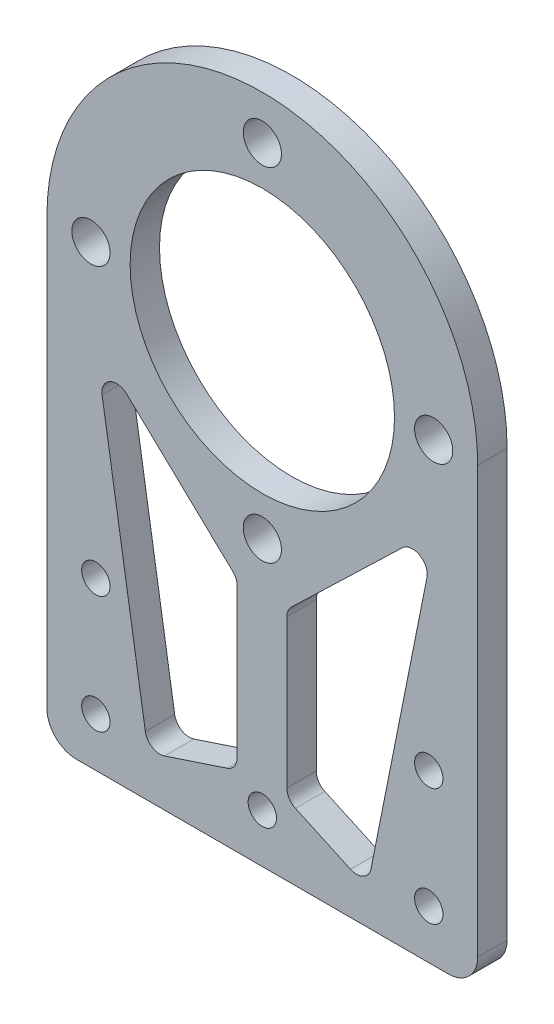
from build123d import *

# Parameters (mm, degrees)
SKETCH_1_R          = 13.5
SKETCH_1_R_2        = 1.95
EXTRUDE_1_DEPTH     = 3
SKETCH_2_R          = 1.45
CUT_EXTRUDE_1_DEPTH = 10
FILLET_1_R          = 3
CUT_EXTRUDE_2_DEPTH = 52.529117982
FILLET_2_R          = 1.5


with BuildPart() as part:
    # 草图1 → 凸台-拉伸1 (new body)
    with BuildSketch(Plane.XY):
        with BuildLine():
            Line((-22, 0), (-22, -46.5))
            Line((-22, -46.5), (22, -46.5))
            Line((22, -46.5), (22, 0))
            ThreePointArc((22, 0), (0, 22), (-22, 0))
        make_face()
        Circle(SKETCH_1_R, mode=Mode.SUBTRACT)
        with Locations((0, 17.5)):
            Circle(SKETCH_1_R_2, mode=Mode.SUBTRACT)
        with Locations((17.5, 0)):
            Circle(SKETCH_1_R_2, mode=Mode.SUBTRACT)
        with Locations((-17.5, 0)):
            Circle(SKETCH_1_R_2, mode=Mode.SUBTRACT)
        with Locations((0, -17.5)):
            Circle(SKETCH_1_R_2, mode=Mode.SUBTRACT)
    extrude(amount=EXTRUDE_1_DEPTH)

    # 草图2 → 切除-拉伸1 (cut)
    with BuildSketch(Plane.XY.offset(3)):
        with Locations((0, -41.5)):
            Circle(SKETCH_2_R)
        with Locations((17, -41.5)):
            Circle(SKETCH_2_R)
        with Locations((-17, -41.5)):
            Circle(SKETCH_2_R)
        with Locations((-17, -29.5)):
            Circle(SKETCH_2_R)
        with Locations((17, -29.5)):
            Circle(SKETCH_2_R)
    extrude(amount=-CUT_EXTRUDE_1_DEPTH, mode=Mode.SUBTRACT)

    # 圆角1
    fillet_1_edges = [part.edges().sort_by_distance(p)[0] for p in [
        (22, -46.5, 1.5),
        (-22, -46.5, 1.5),
    ]]
    fillet(fillet_1_edges, radius=FILLET_1_R)

    # 草图3 → 切除-拉伸2 (cut, through all)
    with BuildSketch(Plane.XY.offset(3)):
        Polygon((17.752585541, -7.827536111), (10.726827306, -43.019057271), (2.50919937, -39.255258217), (2.50919937, -22.502580513), align=None)
        Polygon((-17.062555714, -8.580295922), (-2.571929354, -22.321407125), (-2.571929354, -39.255258217), (-11.667777069, -42.266297461), align=None)
    extrude(amount=-CUT_EXTRUDE_2_DEPTH, mode=Mode.SUBTRACT)

    # 圆角2
    fillet_2_edges = [part.edges().sort_by_distance(p)[0] for p in [
        (2.50919937, -22.502580513, 1.5),
        (17.752585541, -7.827536111, 1.5),
        (10.726827306, -43.019057271, 1.5),
        (2.50919937, -39.255258217, 1.5),
        (-11.667777069, -42.266297461, 1.5),
        (-17.062555714, -8.580295922, 1.5),
        (-2.571929354, -22.321407125, 1.5),
        (-2.571929354, -39.255258217, 1.5),
    ]]
    fillet(fillet_2_edges, radius=FILLET_2_R)


solid = part.part
